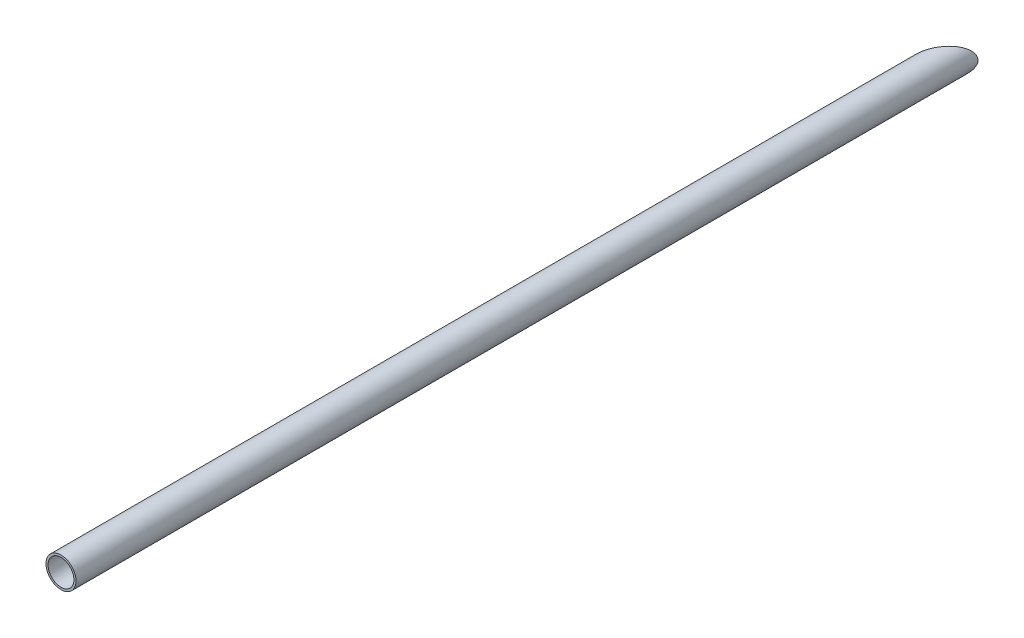
from build123d import *

# Parameters (mm, degrees)
SKETCH1_R               = 12.7
SKETCH1_R_2             = 10.922
BOSS_EXTRUDE1_DEPTH     = 762
CUT_EXTRUDE1_DEPTH      = 763.211637277
CUT_EXTRUDE1_DEPTH_BACK = 763.211637277


with BuildPart() as part:
    # Sketch1 → Boss-Extrude1 (new body)
    with BuildSketch(Plane.XY):
        Circle(SKETCH1_R)
        Circle(SKETCH1_R_2, mode=Mode.SUBTRACT)
    extrude(amount=BOSS_EXTRUDE1_DEPTH)

    # Sketch3 → Cut-Extrude1 (cut, two sides: drawn at the far end of the back side and taken through both)
    with BuildSketch(Plane(origin=(0, 0, 0), x_dir=(1, 0, 0), z_dir=(0, 1, 0)).offset(-CUT_EXTRUDE1_DEPTH_BACK)):
        Polygon((0, 0), (12.7, 0), (-50.8, -90.687398428), (-50.8, 0), align=None)
    extrude(amount=CUT_EXTRUDE1_DEPTH + CUT_EXTRUDE1_DEPTH_BACK, mode=Mode.SUBTRACT)


solid = part.part
